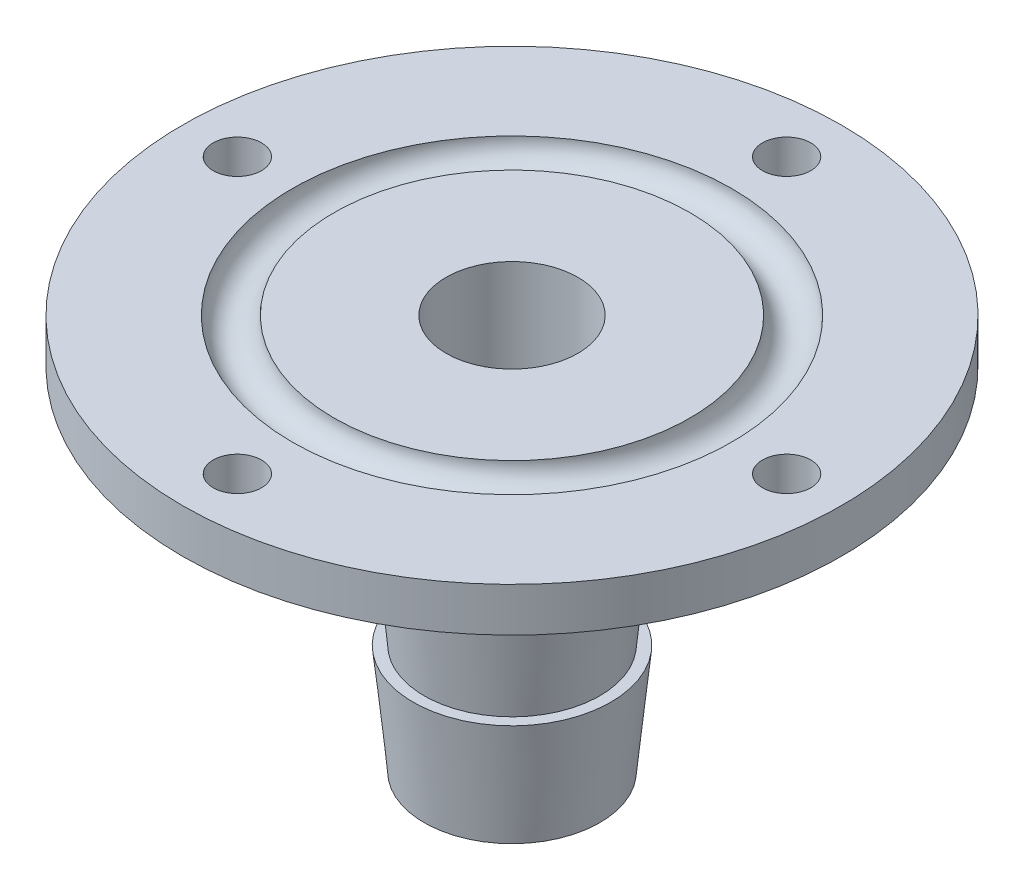
from build123d import *

# Parameters (mm, degrees)
SKETCH_1_R          = 15
SKETCH_1_R_2        = 3
EXTRUDE_1_DEPTH     = 2
SKETCH_2_R          = 0.95
CUT_EXTRUDE_1_REACH = 23.307
SKETCH_3_R          = 1.1
CUT_EXTRUDE_2_REACH = 28.571
SKETCH_5_R          = 3


with BuildPart() as part:
    # 草图1 → 凸台-拉伸1 (new body)
    with BuildSketch(Plane(origin=(0, 0, 0), x_dir=(1, 0, 0), z_dir=(0, 1, 0))):
        with Locations(Location((0, 0, 0), (0, 0, 270))):
            Circle(SKETCH_1_R)
        with Locations(Location((0, 0, 0), (0, 0, 270))):
            Circle(SKETCH_1_R_2, mode=Mode.SUBTRACT)
    extrude(amount=EXTRUDE_1_DEPTH)

    # 草图2 → 切除-旋转1 (revolve, cut)
    with BuildSketch(Plane.XY, mode=Mode.PRIVATE) as cut_revolve_1_sk:
        with Locations((9.05, 2)):
            Circle(SKETCH_2_R)
    revolve(cut_revolve_1_sk.sketch.rotate(Axis((0, 2, 0), (0, 1, 0)), 90), axis=Axis((0, 2, 0), (0, 1, 0)), mode=Mode.SUBTRACT)

    # 草图3 → 切除-拉伸1 (cut, up to next)
    with BuildSketch(Plane(origin=(0, 2, 0), x_dir=(1, 0, 0), z_dir=(0, 1, 0)), mode=Mode.PRIVATE) as cut_extrude_1_sk1:
        with Locations(Location((12.5, 0, 0), (0, 0, 270))):
            Circle(SKETCH_3_R)
    cut_extrude_1_tool1 = extrude(cut_extrude_1_sk1.sketch, amount=-CUT_EXTRUDE_1_REACH, mode=Mode.PRIVATE) & part.part
    # 草图3 → 切除-拉伸1 (cut, up to next)
    with BuildSketch(Plane(origin=(0, 2, 0), x_dir=(1, 0, 0), z_dir=(0, 1, 0)), mode=Mode.PRIVATE) as cut_extrude_1_sk2:
        with Locations(Location((0, -12.5, 0), (0, 0, 270))):
            Circle(SKETCH_3_R)
    cut_extrude_1_tool2 = extrude(cut_extrude_1_sk2.sketch, amount=-CUT_EXTRUDE_1_REACH, mode=Mode.PRIVATE) & part.part
    # 草图3 → 切除-拉伸1 (cut, up to next)
    with BuildSketch(Plane(origin=(0, 2, 0), x_dir=(1, 0, 0), z_dir=(0, 1, 0)), mode=Mode.PRIVATE) as cut_extrude_1_sk3:
        with Locations(Location((-12.5, 0, 0), (0, 0, 270))):
            Circle(SKETCH_3_R)
    cut_extrude_1_tool3 = extrude(cut_extrude_1_sk3.sketch, amount=-CUT_EXTRUDE_1_REACH, mode=Mode.PRIVATE) & part.part
    # 草图3 → 切除-拉伸1 (cut, up to next)
    with BuildSketch(Plane(origin=(0, 2, 0), x_dir=(1, 0, 0), z_dir=(0, 1, 0)), mode=Mode.PRIVATE) as cut_extrude_1_sk4:
        with Locations(Location((0, 12.5, 0), (0, 0, 270))):
            Circle(SKETCH_3_R)
    cut_extrude_1_tool4 = extrude(cut_extrude_1_sk4.sketch, amount=-CUT_EXTRUDE_1_REACH, mode=Mode.PRIVATE) & part.part
    add(cut_extrude_1_tool1.solids().sort_by_distance((12.5, 2, 0))[0], mode=Mode.SUBTRACT)
    add(cut_extrude_1_tool2.solids().sort_by_distance((0, 2, 12.5))[0], mode=Mode.SUBTRACT)
    add(cut_extrude_1_tool3.solids().sort_by_distance((-12.5, 2, 0))[0], mode=Mode.SUBTRACT)
    add(cut_extrude_1_tool4.solids().sort_by_distance((0, 2, -12.5))[0], mode=Mode.SUBTRACT)

    # 草图4 → 旋转1 (revolve)
    with BuildSketch(Plane(origin=(0, 0, 0), x_dir=(0, 0, -1), z_dir=(1, 0, 0))):
        Polygon((4, 0), (0, 0), (0, -16), (4, -16), (4.5, -11), (4, -11), (4.5, -6), (4, -6), (4.5, -1), (4, -1), align=None)
    revolve(axis=Axis((0, -16, 0), (0, 1, 0)))

    # 草图5 → 切除-拉伸2 (cut, up to next)
    with BuildSketch(Plane(origin=(0, 0, 0), x_dir=(1, 0, 0), z_dir=(0, 1, 0)), mode=Mode.PRIVATE) as cut_extrude_2_sk1:
        with Locations(Location((0, 0, 0), (0, 0, 270))):
            Circle(SKETCH_5_R)
    cut_extrude_2_tool1 = extrude(cut_extrude_2_sk1.sketch, amount=-CUT_EXTRUDE_2_REACH, mode=Mode.PRIVATE) & part.part
    add(cut_extrude_2_tool1.solids().sort_by_distance((0, 0, 0))[0], mode=Mode.SUBTRACT)


solid = part.part
